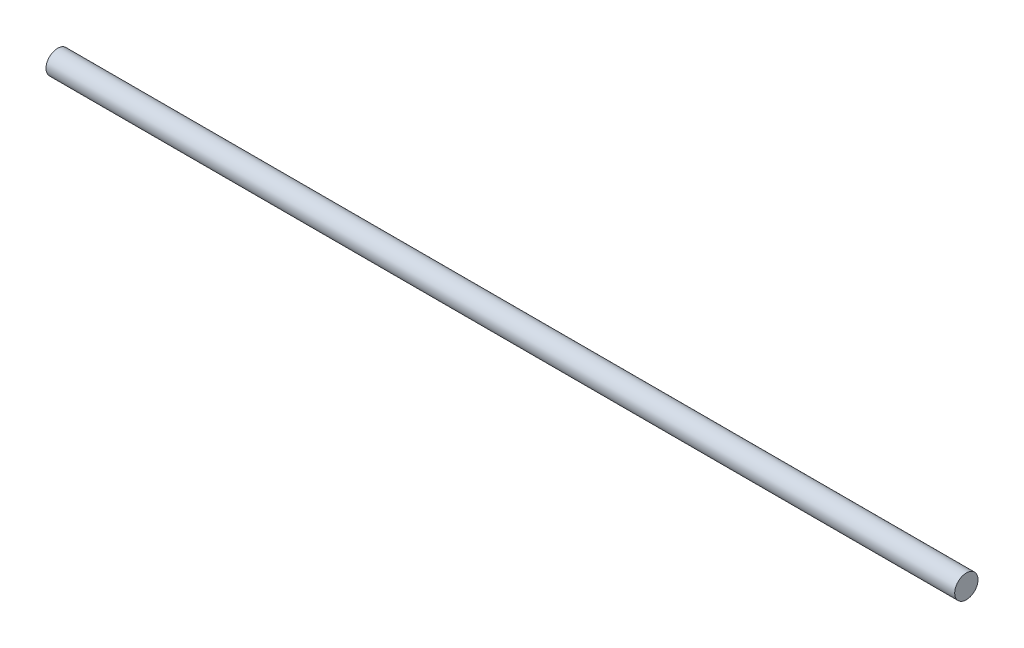
from build123d import *

# Parameters (mm, degrees)
SKETCH1_R           = 5
BOSS_EXTRUDE1_DEPTH = 390


with BuildPart() as part:
    # Sketch1 → Boss-Extrude1 (new body)
    with BuildSketch(Plane(origin=(0, 0, 0), x_dir=(0, 0, -1), z_dir=(1, 0, 0))):
        Circle(SKETCH1_R)
    extrude(amount=BOSS_EXTRUDE1_DEPTH)


solid = part.part
